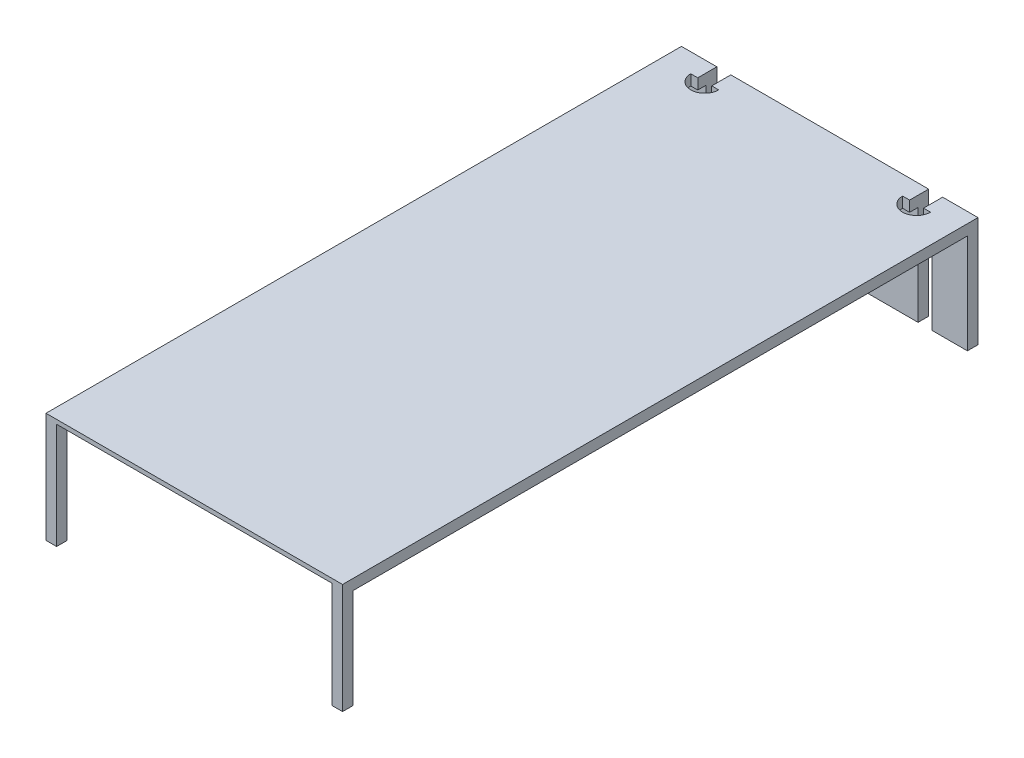
from build123d import *

# Parameters (mm, degrees)
BOSS_EXTRUDE1_DEPTH     = 26
CUT_EXTRUDE1_DEPTH      = 106.834776893
CUT_EXTRUDE1_DEPTH_BACK = 106.834776893
SKETCH3_W               = 145
SKETCH3_H               = 23.5
CUT_EXTRUDE2_DEPTH      = 157.208194407
CUT_EXTRUDE2_DEPTH_BACK = 26
SKETCH4_W               = 65
SKETCH4_H               = 25


with BuildPart() as part:
    # Sketch2 → Boss-Extrude1 (new body)
    with BuildSketch(Plane(origin=(0, 0, 0), x_dir=(1, 0, 0), z_dir=(0, 1, 0))):
        with BuildLine():
            Line((-26.65, 70.5), (-26.65, 75))
            Line((-26.65, 75), (-35, 75))
            Line((-35, 75), (-35, -75))
            Line((-35, -75), (35, -75))
            Line((35, -75), (35, 75))
            Line((35, 75), (26.65, 75))
            Line((26.65, 75), (26.65, 70.5))
            Line((26.65, 70.5), (28.3, 70.5))
            ThreePointArc((28.3, 70.5), (25, 67.2), (21.7, 70.5))
            Line((21.7, 70.5), (23.35, 70.5))
            Line((23.35, 70.5), (23.35, 75))
            Line((23.35, 75), (-23.35, 75))
            Line((-23.35, 75), (-23.35, 70.5))
            Line((-23.35, 70.5), (-21.7, 70.5))
            ThreePointArc((-21.7, 70.5), (-25, 67.2), (-28.3, 70.5))
            Line((-28.3, 70.5), (-26.65, 70.5))
        make_face()
    extrude(amount=BOSS_EXTRUDE1_DEPTH)

    # Sketch3 → Cut-Extrude1 (cut, two sides: drawn at the far end of the back side and taken through both)
    with BuildSketch(Plane(origin=(35, 0, 0), x_dir=(0, 0, -1), z_dir=(1, 0, 0)).offset(-CUT_EXTRUDE1_DEPTH_BACK)):
        with Locations((0, 11.75)):
            Rectangle(SKETCH3_W, SKETCH3_H)
    extrude(amount=CUT_EXTRUDE1_DEPTH + CUT_EXTRUDE1_DEPTH_BACK, mode=Mode.SUBTRACT)

    # Sketch4 → Cut-Extrude2 (cut, two sides: drawn at the far end of the back side and taken through both)
    with BuildSketch(Plane.XY.offset(75).offset(-CUT_EXTRUDE2_DEPTH_BACK)):
        with Locations((0, 12.5)):
            Rectangle(SKETCH4_W, SKETCH4_H)
    extrude(amount=CUT_EXTRUDE2_DEPTH + CUT_EXTRUDE2_DEPTH_BACK, mode=Mode.SUBTRACT)


solid = part.part
